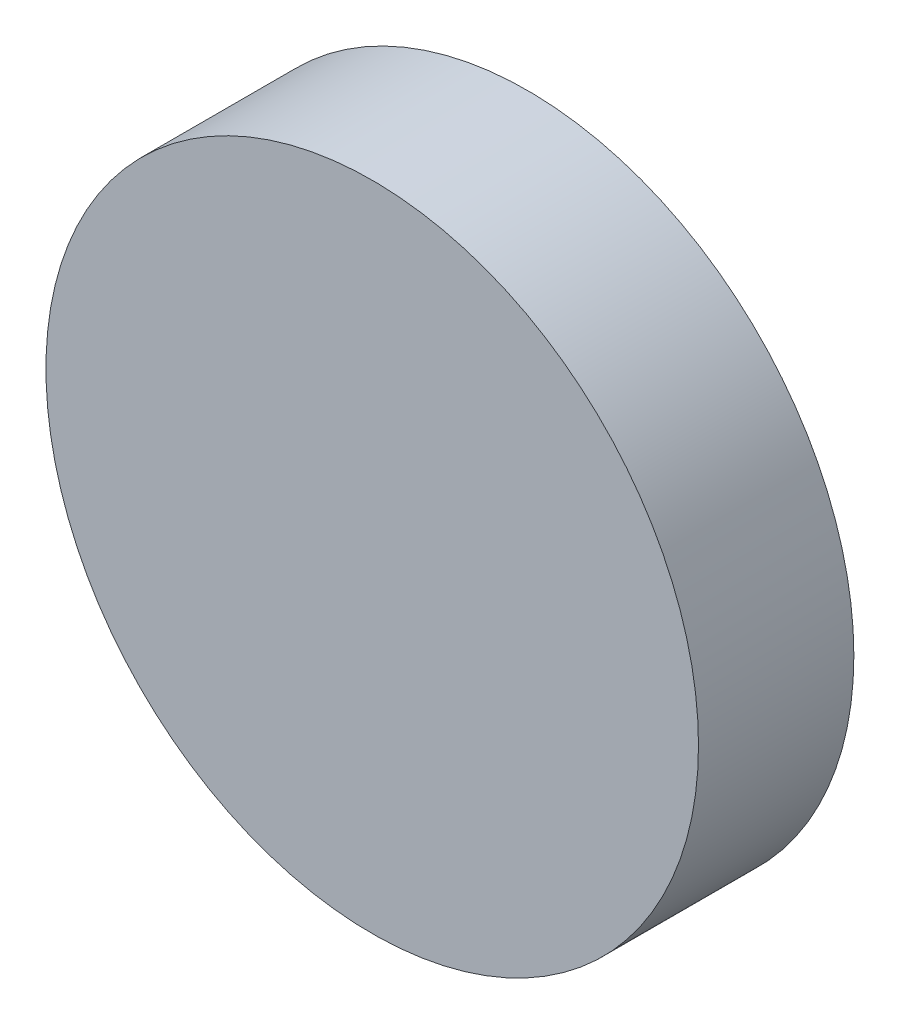
from build123d import *

# Parameters (mm, degrees)
ESQUISSE1_R        = 105
BOSS_EXTRU_1_DEPTH = 50


with BuildPart() as part:
    # Esquisse1 → Boss.-Extru.1 (new body)
    with BuildSketch(Plane.XY):
        Circle(ESQUISSE1_R)
    extrude(amount=BOSS_EXTRU_1_DEPTH)


solid = part.part
